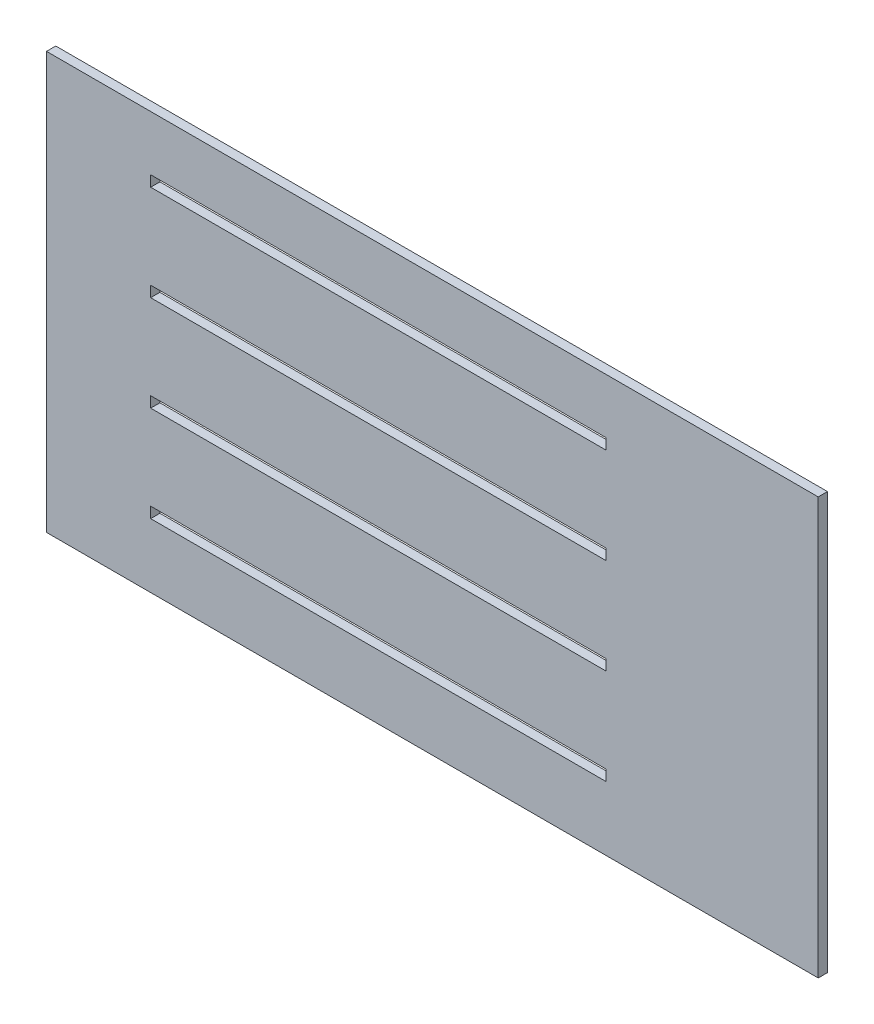
from build123d import *

# Parameters (mm, degrees)
BOSS_EXTRUDE1_DEPTH = 3
SKETCH3_W           = 147.5
SKETCH3_H           = 3.5
SKETCH3_W_2         = 147
SKETCH3_H_2         = 3
CUT_EXTRUDE2_DEPTH  = 3


with BuildPart() as part:
    # Sketch1 → Boss-Extrude1 (new body)
    with BuildSketch(Plane.XY):
        Polygon((79.894045329, 76.229765013), (148.894045329, 76.229765013), (148.894045329, -58.770234987), (79.894045329, -58.770234987), (-67.167101828, -58.770234987), (-72.167101828, -58.770234987), (-98.167101828, -58.770234987), (-101.167101828, -58.770234987), (-101.167101828, 76.229765013), (-98.167101828, 76.229765013), (-72.167101828, 76.229765013), (-67.167101828, 76.229765013), align=None)
    extrude(amount=-BOSS_EXTRUDE1_DEPTH)

    # Sketch3 → Cut-Extrude2 (cut)
    # profile 1 of 4: a face of its own
    with BuildSketch(Plane.XY):
        with Locations((6.332898172, 56.729765013)):
            Rectangle(SKETCH3_W, SKETCH3_H)
        with Locations((6.332898172, 56.729765013)):
            Rectangle(SKETCH3_W_2, SKETCH3_H_2, mode=Mode.SUBTRACT)
    # profile 2 of 4: a face of its own
    with BuildSketch(Plane.XY):
        with Locations((6.332898172, 25.729765013)):
            Rectangle(SKETCH3_W, SKETCH3_H)
        with Locations((6.332898172, 25.729765013)):
            Rectangle(SKETCH3_W_2, SKETCH3_H_2, mode=Mode.SUBTRACT)
    # profile 3 of 4: a face of its own
    with BuildSketch(Plane.XY):
        with Locations((6.332898172, -5.270234987)):
            Rectangle(SKETCH3_W, SKETCH3_H)
        with Locations((6.332898172, -5.270234987)):
            Rectangle(SKETCH3_W_2, SKETCH3_H_2, mode=Mode.SUBTRACT)
    # profile 4 of 4: a face of its own
    with BuildSketch(Plane.XY):
        with Locations((6.332898172, -36.270234987)):
            Rectangle(SKETCH3_W, SKETCH3_H)
        with Locations((6.332898172, -36.270234987)):
            Rectangle(SKETCH3_W_2, SKETCH3_H_2, mode=Mode.SUBTRACT)
    extrude(amount=-CUT_EXTRUDE2_DEPTH, mode=Mode.SUBTRACT)


with BuildPart() as body_2:
    # of the pieces the cut leaves, the one that is kept (cut_extrude2_keep)
    add(part.part.solids().sort_by_distance((148.894045329, 76.229765013, 0))[0])


solid = body_2.part
